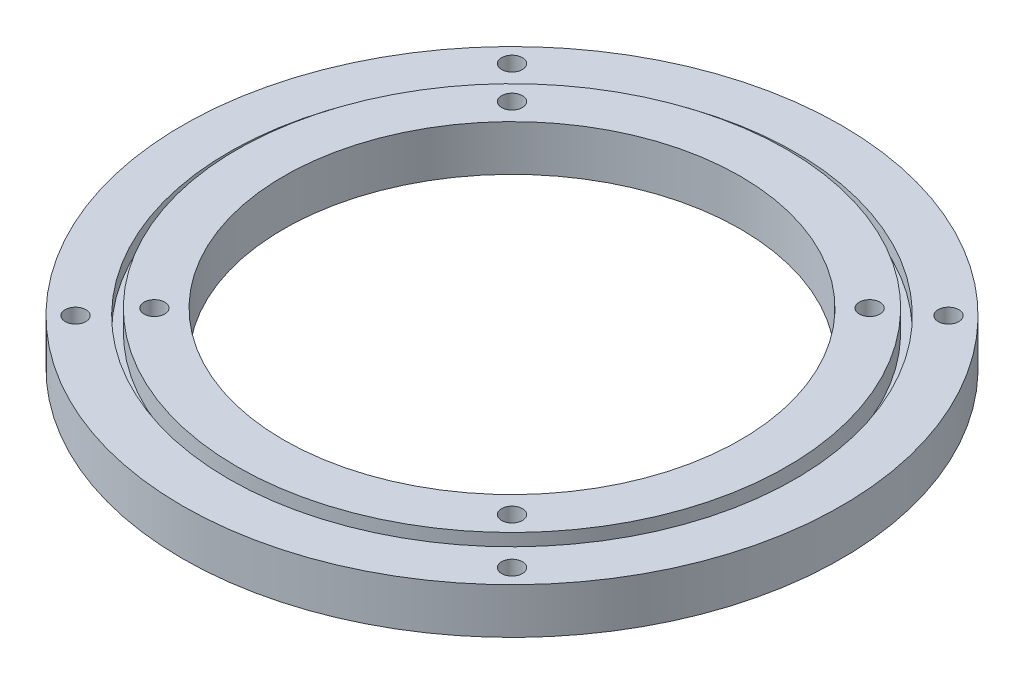
from build123d import *

# Parameters (mm, degrees)
SKETCH1_R             = 101
SKETCH1_R_2           = 3.175
SKETCH1_R_3           = 86.77
BOSS_EXTRUDE1_DEPTH   = 6
SKETCH1_R_4           = 84.23
SKETCH1_R_5           = 70
BOSS_EXTRUDE1_2_DEPTH = 6
SKETCH1_3_R           = 86.77
SKETCH1_3_R_2         = 84.23
BOSS_EXTRUDE2_DEPTH   = 1.5875
BOSS_EXTRUDE3_START   = 6
SKETCH1_4_R           = 84.23
SKETCH1_4_R_2         = 3.175
SKETCH1_4_R_3         = 70
BOSS_EXTRUDE3_DEPTH   = 2
BOSS_EXTRUDE4_START   = -8
SKETCH1_5_R           = 101
SKETCH1_5_R_2         = 3.175
SKETCH1_5_R_3         = 86.77
BOSS_EXTRUDE4_DEPTH   = 2


with BuildPart() as part:
    # Sketch1 → Boss-Extrude1 (new, symmetric)
    with BuildSketch(Plane(origin=(0, 0, 0), x_dir=(1, 0, 0), z_dir=(0, 1, 0))):
        with Locations(Location((0, 0, 0), (0, 0, 270))):
            Circle(SKETCH1_R)
        with Locations(Location((-66.888765966, -66.888765966, 0), (0, 0, 270))):
            Circle(SKETCH1_R_2, mode=Mode.SUBTRACT)
        with Locations(Location((66.888765966, 66.888765966, 0), (0, 0, 270))):
            Circle(SKETCH1_R_2, mode=Mode.SUBTRACT)
        with Locations(Location((0, 0, 0), (0, 0, 270))):
            Circle(SKETCH1_R_3, mode=Mode.SUBTRACT)
        with Locations(Location((66.888765966, -66.888765966, 0), (0, 0, 270))):
            Circle(SKETCH1_R_2, mode=Mode.SUBTRACT)
        with Locations(Location((-66.888765966, 66.888765966, 0), (0, 0, 270))):
            Circle(SKETCH1_R_2, mode=Mode.SUBTRACT)
    extrude(amount=BOSS_EXTRUDE1_DEPTH, both=True)



with BuildPart() as body_2:
    # Sketch1 → Boss-Extrude1 2 (new, symmetric)
    with BuildSketch(Plane(origin=(0, 0, 0), x_dir=(1, 0, 0), z_dir=(0, 1, 0))):
        with Locations(Location((0, 0, 0), (0, 0, 270))):
            Circle(SKETCH1_R_4)
        with Locations(Location((-54.800775542, 54.800775542, 0), (0, 0, 270))):
            Circle(SKETCH1_R_2, mode=Mode.SUBTRACT)
        with Locations(Location((-54.800775542, -54.800775542, 0), (0, 0, 270))):
            Circle(SKETCH1_R_2, mode=Mode.SUBTRACT)
        with Locations(Location((54.800775542, -54.800775542, 0), (0, 0, 270))):
            Circle(SKETCH1_R_2, mode=Mode.SUBTRACT)
        with Locations(Location((54.800775542, 54.800775542, 0), (0, 0, 270))):
            Circle(SKETCH1_R_2, mode=Mode.SUBTRACT)
        with Locations(Location((0, 0, 0), (0, 0, 270))):
            Circle(SKETCH1_R_5, mode=Mode.SUBTRACT)
    extrude(amount=BOSS_EXTRUDE1_2_DEPTH, both=True)


with BuildPart() as part_1:
    add(part.part)

    add(body_2.part)  # Boss-Extrude2 merges body 2
    # Sketch1<3> → Boss-Extrude2 (add, symmetric)
    with BuildSketch(Plane(origin=(0, 0, 0), x_dir=(1, 0, 0), z_dir=(0, 1, 0))):
        with Locations(Location((0, 0, 0), (0, 0, 270))):
            Circle(SKETCH1_3_R)
        with Locations(Location((0, 0, 0), (0, 0, 270))):
            Circle(SKETCH1_3_R_2, mode=Mode.SUBTRACT)
    extrude(amount=BOSS_EXTRUDE2_DEPTH, both=True)

    # Sketch1<4> → Boss-Extrude3 (add)
    with BuildSketch(Plane(origin=(0, 0, 0), x_dir=(1, 0, 0), z_dir=(0, 1, 0)).offset(BOSS_EXTRUDE3_START)):
        with Locations(Location((0, 0, 0), (0, 0, 270))):
            Circle(SKETCH1_4_R)
        with Locations(Location((-54.800775542, 54.800775542, 0), (0, 0, 270))):
            Circle(SKETCH1_4_R_2, mode=Mode.SUBTRACT)
        with Locations(Location((-54.800775542, -54.800775542, 0), (0, 0, 270))):
            Circle(SKETCH1_4_R_2, mode=Mode.SUBTRACT)
        with Locations(Location((54.800775542, -54.800775542, 0), (0, 0, 270))):
            Circle(SKETCH1_4_R_2, mode=Mode.SUBTRACT)
        with Locations(Location((54.800775542, 54.800775542, 0), (0, 0, 270))):
            Circle(SKETCH1_4_R_2, mode=Mode.SUBTRACT)
        with Locations(Location((0, 0, 0), (0, 0, 270))):
            Circle(SKETCH1_4_R_3, mode=Mode.SUBTRACT)
    extrude(amount=BOSS_EXTRUDE3_DEPTH)

    # Sketch1<5> → Boss-Extrude4 (add)
    with BuildSketch(Plane(origin=(0, 0, 0), x_dir=(1, 0, 0), z_dir=(0, 1, 0)).offset(BOSS_EXTRUDE4_START)):
        with Locations(Location((0, 0, 0), (0, 0, 270))):
            Circle(SKETCH1_5_R)
        with Locations(Location((-66.888765966, -66.888765966, 0), (0, 0, 270))):
            Circle(SKETCH1_5_R_2, mode=Mode.SUBTRACT)
        with Locations(Location((66.888765966, 66.888765966, 0), (0, 0, 270))):
            Circle(SKETCH1_5_R_2, mode=Mode.SUBTRACT)
        with Locations(Location((0, 0, 0), (0, 0, 270))):
            Circle(SKETCH1_5_R_3, mode=Mode.SUBTRACT)
        with Locations(Location((66.888765966, -66.888765966, 0), (0, 0, 270))):
            Circle(SKETCH1_5_R_2, mode=Mode.SUBTRACT)
        with Locations(Location((-66.888765966, 66.888765966, 0), (0, 0, 270))):
            Circle(SKETCH1_5_R_2, mode=Mode.SUBTRACT)
    extrude(amount=BOSS_EXTRUDE4_DEPTH)


solid = part_1.part
